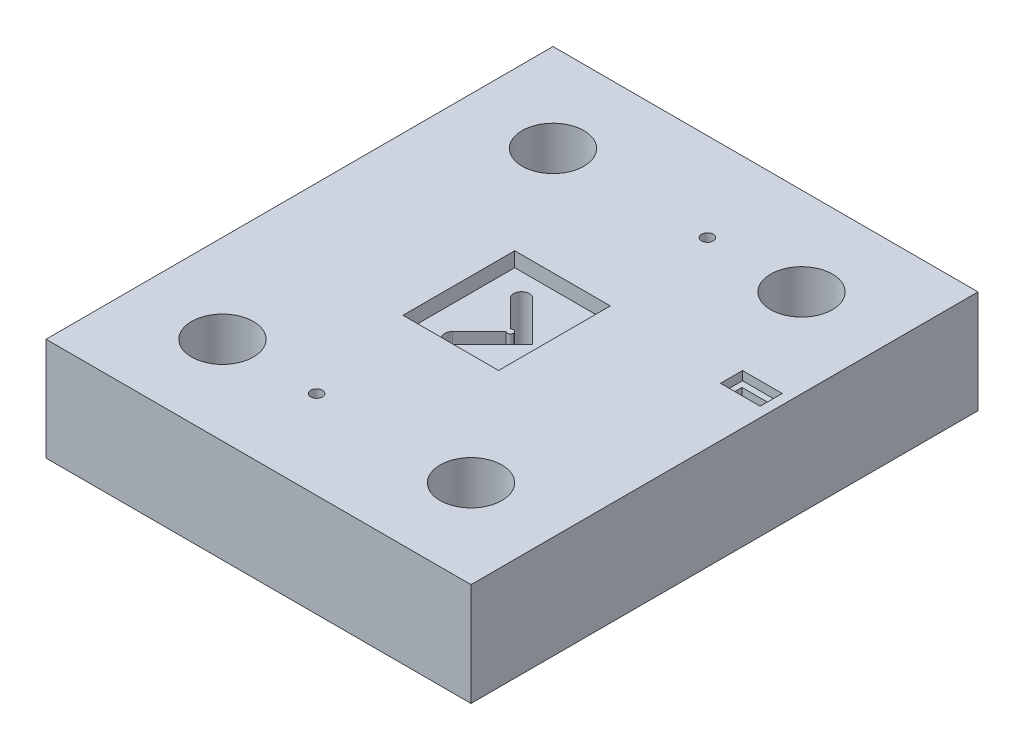
from build123d import *

# Parameters (mm, degrees)
SKETCH1_W           = 144.5
SKETCH1_H           = 172.38
BOSS_EXTRUDE1_DEPTH = 35
SKETCH2_R           = 10.5
SKETCH2_R_2         = 1.99
CUT_EXTRUDE1_DEPTH  = 118.787005226
SKETCH3_R           = 15.25
CUT_EXTRUDE2_DEPTH  = 20
SKETCH4_W           = 32.5
SKETCH4_H           = 38
CUT_EXTRUDE3_DEPTH  = 5
SKETCH5_W           = 13.5
SKETCH5_H           = 7.5
CUT_EXTRUDE4_DEPTH  = 3
CUT_EXTRUDE5_DEPTH  = 80


with BuildPart() as part:
    # Sketch1 → Boss-Extrude1 (new body)
    with BuildSketch(Plane(origin=(0, 0, 0), x_dir=(1, 0, 0), z_dir=(0, 1, 0))):
        Rectangle(SKETCH1_W, SKETCH1_H)
    extrude(amount=BOSS_EXTRUDE1_DEPTH)

    # Sketch2 → Cut-Extrude1 (cut, through all)
    with BuildSketch(Plane.XZ):
        with Locations(Location((-42.25, -56.19, 0), (0, 0, 270))):
            Circle(SKETCH2_R)
        with Locations(Location((10.25, -56.19, 0), (0, 0, 270))):
            Circle(SKETCH2_R_2)
        with Locations(Location((42.25, -56.19, 0), (0, 0, 270))):
            Circle(SKETCH2_R)
        with Locations(Location((-10.25, 56.19, 0), (0, 0, 270))):
            Circle(SKETCH2_R_2)
        with Locations(Location((-42.25, 56.19, 0), (0, 0, 270))):
            Circle(SKETCH2_R)
        with Locations(Location((42.25, 56.19, 0), (0, 0, 270))):
            Circle(SKETCH2_R)
        Polygon((57.25, -20.94), (67.25, -20.94), (67.25, -17.44), (65.25, -17.44), (65.25, -17.94), (59.25, -17.94), (59.25, -17.44), (57.25, -17.44), align=None)
    extrude(amount=-CUT_EXTRUDE1_DEPTH, mode=Mode.SUBTRACT)

    # Sketch3 → Cut-Extrude2 (cut)
    with BuildSketch(Plane.XZ):
        with Locations(Location((-42.25, -56.19, 0), (0, 0, 270))):
            Circle(SKETCH3_R)
        with Locations(Location((42.25, -56.19, 0), (0, 0, 270))):
            Circle(SKETCH3_R)
        with Locations(Location((-42.25, 56.19, 0), (0, 0, 270))):
            Circle(SKETCH3_R)
        with Locations(Location((42.25, 56.19, 0), (0, 0, 270))):
            Circle(SKETCH3_R)
    extrude(amount=-CUT_EXTRUDE2_DEPTH, mode=Mode.SUBTRACT)

    # Sketch4 → Cut-Extrude3 (cut)
    with BuildSketch(Plane(origin=(0, 35, 0), x_dir=(1, 0, 0), z_dir=(0, 1, 0))):
        with Locations((-2.371711624, 0.554154498)):
            Rectangle(SKETCH4_W, SKETCH4_H)
    extrude(amount=-CUT_EXTRUDE3_DEPTH, mode=Mode.SUBTRACT)

    # Sketch5 → Cut-Extrude4 (cut)
    with BuildSketch(Plane(origin=(0, 35, 0), x_dir=(1, 0, 0), z_dir=(0, 1, 0))):
        with Locations((62.129216634, 19.25371769)):
            Rectangle(SKETCH5_W, SKETCH5_H)
    extrude(amount=-CUT_EXTRUDE4_DEPTH, mode=Mode.SUBTRACT)

    # Sketch6 → Cut-Extrude5 (cut)
    with BuildSketch(Plane.XZ):
        with BuildLine():
            Line((-1.305437085, -0.763536662), (-10.413111088, -9.871210665))
            ThreePointArc((-10.413111088, -9.871210665), (-10.413111088, -13.661303013), (-6.623018741, -13.661303013))
            Line((-6.623018741, -13.661303013), (7.01, -0.028284271))
            Line((7.01, -0.028284271), (-6.623018741, 13.60473447))
            ThreePointArc((-6.623018741, 13.60473447), (-10.413111088, 13.60473447), (-10.413111088, 9.814642123))
            Line((-10.413111088, 9.814642123), (-1.305437085, 0.706968119))
            ThreePointArc((-1.305437085, 0.706968119), (0.421531034, -0.028284271), (-1.305437085, -0.763536662))
        make_face()
    extrude(amount=-CUT_EXTRUDE5_DEPTH, mode=Mode.SUBTRACT)


solid = part.part
